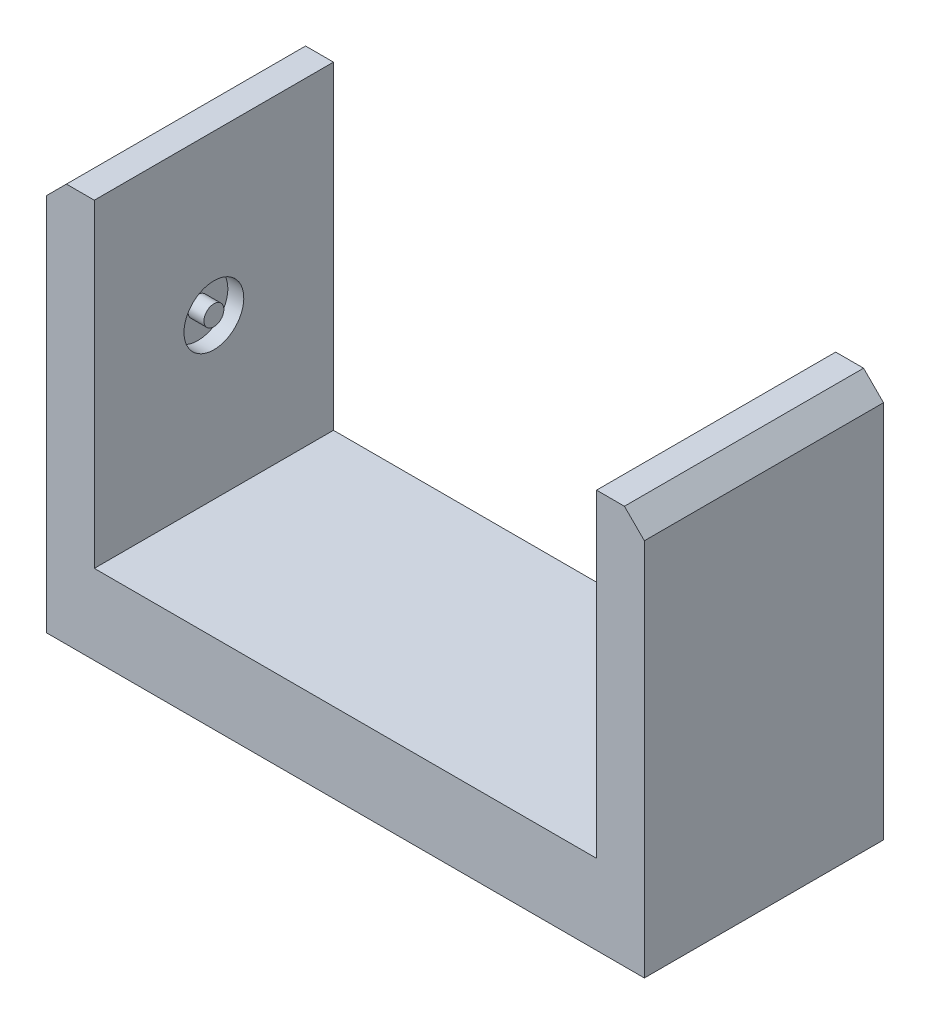
from build123d import *

# Parameters (mm, degrees)
EXTRUDE_1_DEPTH     = 30
SKETCH_2_R          = 20
SKETCH_2_R_2        = 18
EXTRUDE_2_DEPTH     = 10
SKETCH_3_R          = 7.5
SKETCH_3_R_2        = 2.5
CUT_EXTRUDE_1_DEPTH = 4


with BuildPart() as part:
    # 草图1 → 凸台-拉伸1 (new, symmetric)
    with BuildSketch(Plane.XY):
        Polygon((-63, 100), (-70, 100), (-75, 95), (-75, 0), (0, 0), (0, 20), (-63, 20), align=None)
        Polygon((63, 20), (0, 20), (0, 0), (75, 0), (75, 95), (70, 100), (63, 100), align=None)
    extrude(amount=EXTRUDE_1_DEPTH, both=True)

    # 草图2 → 凸台-拉伸2 (add)
    with BuildSketch(Plane.XZ):
        with Locations(Location((0, 0, 0), (0, 0, 180))):
            Circle(SKETCH_2_R)
        Circle(SKETCH_2_R_2, mode=Mode.SUBTRACT)
    extrude(amount=EXTRUDE_2_DEPTH)

    # 草图3 → 切除-拉伸1 (cut)
    with BuildSketch(Plane(origin=(-63, 0, 0), x_dir=(0, 0, -1), z_dir=(1, 0, 0))):
        with Locations(Location((0, 60, 0), (0, 0, 90))):
            Circle(SKETCH_3_R)
        with Locations(Location((0, 60, 0), (0, 0, 90))):
            Circle(SKETCH_3_R_2, mode=Mode.SUBTRACT)
    cut_extrude_1 = extrude(amount=-CUT_EXTRUDE_1_DEPTH, mode=Mode.SUBTRACT)

    # 镜向1: 切除-拉伸1 across plane
    add(cut_extrude_1.mirror(Plane(origin=(0, 0, 0), x_dir=(0, 0, 1), z_dir=(1, 0, 0))), mode=Mode.SUBTRACT)


solid = part.part
